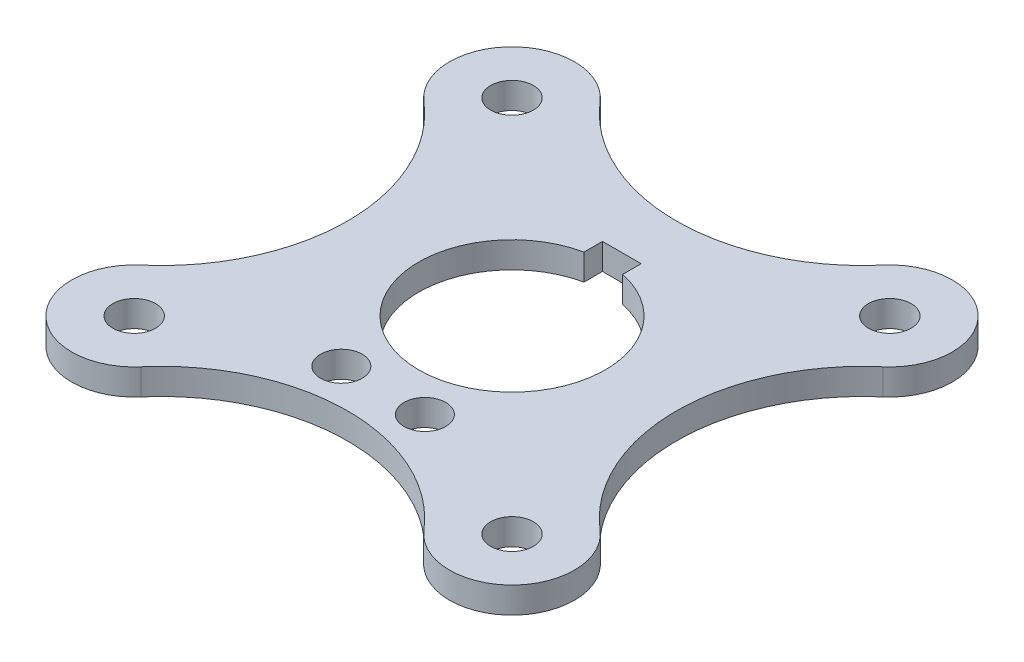
from build123d import *

# Parameters (mm, degrees)
SKETCH1_R           = 2.6
BOSS_EXTRUDE1_DEPTH = 3.175
SKETCH2_R           = 2.54
CUT_EXTRUDE1_DEPTH  = 10


with BuildPart() as part:
    # Sketch1 → Boss-Extrude1 (new body)
    with BuildSketch(Plane(origin=(0, 0, 0), x_dir=(1, 0, 0), z_dir=(0, 1, 0))):
        with BuildLine():
            ThreePointArc((-17.206636662, 27.922333563), (-28.354981926, 28.354981926), (-27.922333563, 17.206636662))
            ThreePointArc((-27.922333563, 17.206636662), (-20, 0), (-27.922333563, -17.206636662))
            ThreePointArc((-27.922333563, -17.206636662), (-28.354981926, -28.354981926), (-17.206636662, -27.922333563))
            ThreePointArc((-17.206636662, -27.922333563), (0, -20), (17.206636662, -27.922333563))
            ThreePointArc((17.206636662, -27.922333563), (28.354981926, -28.354981926), (27.922333563, -17.206636662))
            ThreePointArc((27.922333563, -17.206636662), (20, 0), (27.922333563, 17.206636662))
            ThreePointArc((27.922333563, 17.206636662), (28.354981926, 28.354981926), (17.206636662, 27.922333563))
            ThreePointArc((17.206636662, 27.922333563), (0, 20), (-17.206636662, 27.922333563))
        make_face()
        with Locations(Location((22.980970389, 22.980970389, 0), (0, 0, 270))):
            Circle(SKETCH1_R, mode=Mode.SUBTRACT)
        with Locations(Location((22.980970389, -22.980970389, 0), (0, 0, 270))):
            Circle(SKETCH1_R, mode=Mode.SUBTRACT)
        with Locations(Location((-22.980970389, -22.980970389, 0), (0, 0, 270))):
            Circle(SKETCH1_R, mode=Mode.SUBTRACT)
        with Locations(Location((-22.980970389, 22.980970389, 0), (0, 0, 270))):
            Circle(SKETCH1_R, mode=Mode.SUBTRACT)
        with BuildLine():
            Line((2.353261567, 13.359444444), (-2.353261567, 13.359444444))
            Line((-2.353261567, 13.359444444), (-2.353261567, 11.113016606))
            ThreePointArc((-2.353261567, 11.113016606), (0, -11.359444444), (2.353261567, 11.113016606))
            Line((2.353261567, 11.113016606), (2.353261567, 13.359444444))
        make_face(mode=Mode.SUBTRACT)
    extrude(amount=BOSS_EXTRUDE1_DEPTH)

    # Sketch2 → Cut-Extrude1 (cut)
    with BuildSketch(Plane(origin=(0, 3.175, 0), x_dir=(1, 0, 0), z_dir=(0, 1, 0))):
        with Locations(Location((-5.08, -15.679722222, 0), (0, 0, 270))):
            Circle(SKETCH2_R)
        with Locations(Location((5.08, -15.679722222, 0), (0, 0, 270))):
            Circle(SKETCH2_R)
    extrude(amount=-CUT_EXTRUDE1_DEPTH, mode=Mode.SUBTRACT)


solid = part.part
